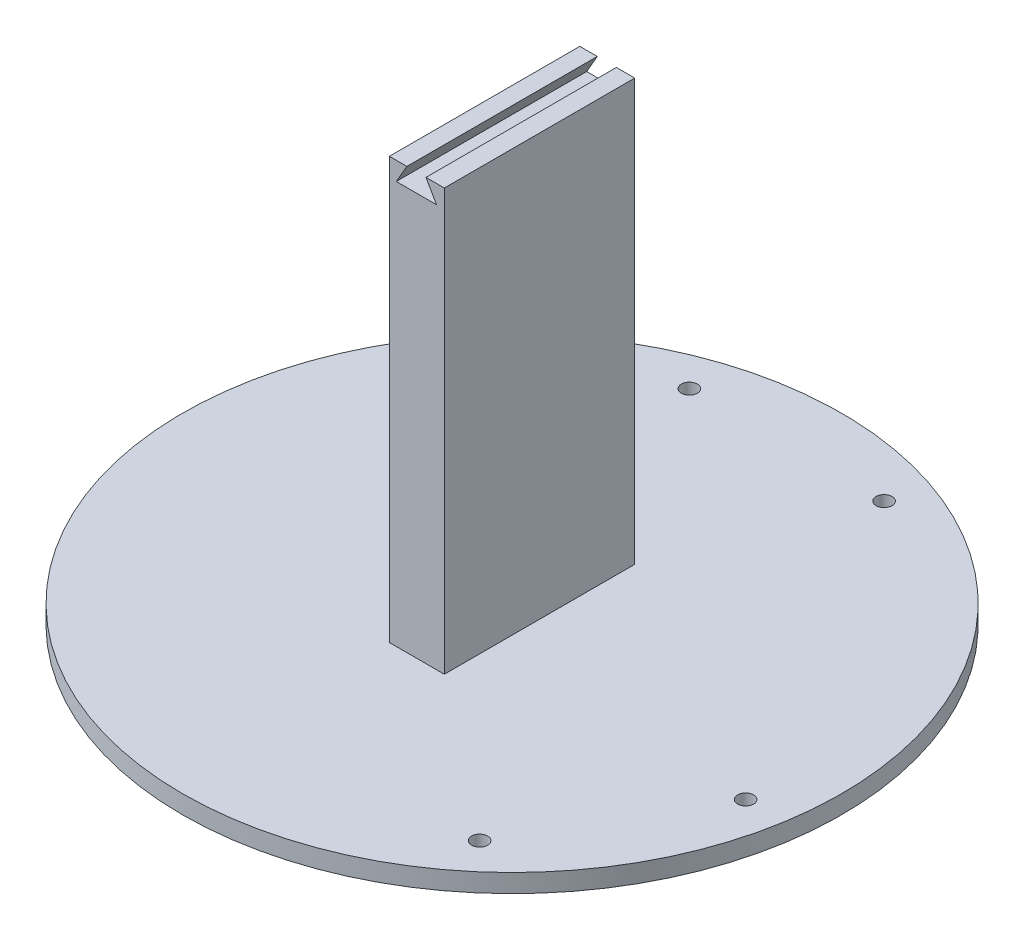
from build123d import *

# Parameters (mm, degrees)
SKETCH1_R           = 90
BOSS_EXTRUDE2_DEPTH = 5
SKETCH3_W           = 15
SKETCH3_H           = 52
BOSS_EXTRUDE3_DEPTH = 120
CUT_EXTRUDE1_DEPTH  = 80
SKETCH8_R           = 2.1825
SKETCH8_R_2         = 2.18255
CUT_EXTRUDE3_DEPTH  = 80


with BuildPart() as part:
    # Sketch1 → Boss-Extrude2 (new body)
    with BuildSketch(Plane(origin=(0, 0, 0), x_dir=(1, 0, 0), z_dir=(0, 1, 0))):
        with Locations(Location((0, 0, 0), (0, 0, 270))):
            Circle(SKETCH1_R)
    extrude(amount=BOSS_EXTRUDE2_DEPTH)

    # Sketch3 → Boss-Extrude3 (add)
    with BuildSketch(Plane(origin=(0, 0, 0), x_dir=(1, 0, 0), z_dir=(0, 1, 0))):
        Rectangle(SKETCH3_W, SKETCH3_H)
    extrude(amount=BOSS_EXTRUDE3_DEPTH)

    # Sketch5 → Cut-Extrude1 (cut)
    with BuildSketch(Plane.XY.offset(26)):
        Polygon((-5.619057526, 114.98), (-2.720759175, 120), (2.482644122, 120), (5.380942474, 114.98), align=None)
    extrude(amount=-CUT_EXTRUDE1_DEPTH, mode=Mode.SUBTRACT)

    # Sketch8 → Cut-Extrude3 (cut)
    with BuildSketch(Plane.XZ):
        with Locations(Location((26.586875, -75, 0), (0, 0, 270))):
            Circle(SKETCH8_R)
        with Locations(Location((-26.586875, -75, 0), (0, 0, 270))):
            Circle(SKETCH8_R_2)
        with Locations(Location((51.659405284, 60.52328536, 0), (0, 0, 270))):
            Circle(SKETCH8_R)
        with Locations(Location((78.244405284, 14.47671464, 0), (0, 0, 270))):
            Circle(SKETCH8_R)
    extrude(amount=-CUT_EXTRUDE3_DEPTH, mode=Mode.SUBTRACT)


solid = part.part
